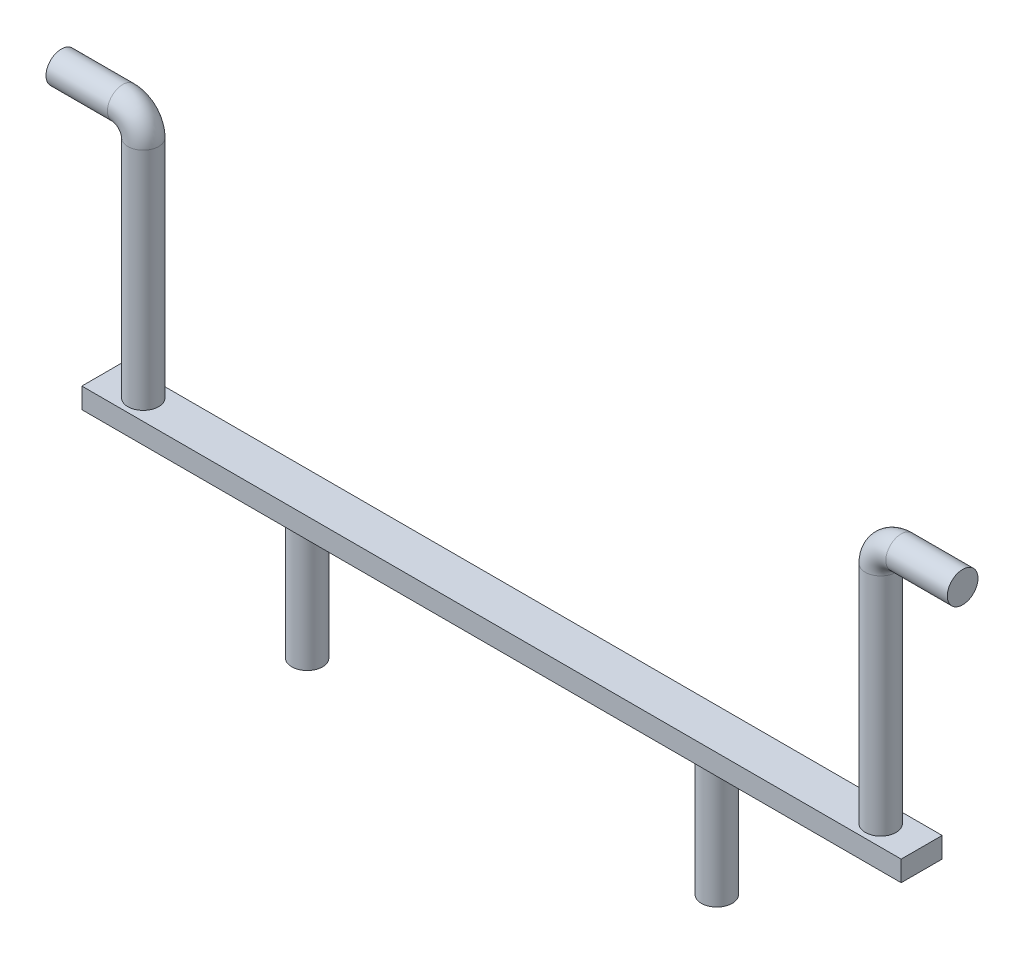
from build123d import *

# Parameters (mm, degrees)
SKETCH1_W           = 508
SKETCH1_H           = 25.4
BOSS_EXTRUDE1_DEPTH = 12.7
SKETCH3_R           = 9.525
BOSS_EXTRUDE2_DEPTH = 76.2
SWEEP1_PROFILE_R    = 9.525


with BuildPart() as part:
    # Sketch1 → Boss-Extrude1 (new body)
    with BuildSketch(Plane(origin=(0, 0, 0), x_dir=(1, 0, 0), z_dir=(0, 1, 0))):
        Rectangle(SKETCH1_W, SKETCH1_H)
    extrude(amount=BOSS_EXTRUDE1_DEPTH)

    # Sketch3 → Boss-Extrude2 (add)
    with BuildSketch(Plane.XZ):
        with Locations(Location((-127, 0, 0), (0, 0, 90))):
            Circle(SKETCH3_R)
        with Locations(Location((127, 0, 0), (0, 0, 90))):
            Circle(SKETCH3_R)
    extrude(amount=BOSS_EXTRUDE2_DEPTH)

    # Sweep1: sweep along a path in Sketch4
    with BuildLine(Plane.XY) as sweep1_path:
        Line((-228.6, 12.7), (-228.6, 152.4))
        ThreePointArc((-228.6, 152.4), (-232.319743879, 161.380256121), (-241.3, 165.1))
        Line((-241.3, 165.1), (-279.4, 165.1))
    # Sweep1 profile (on start of the path) → Sweep1 (sweep)
    with BuildSketch(Plane(origin=(-228.6, 12.7, 0), x_dir=(0, 0, 1), z_dir=(0, 1, 0))):
        Circle(SWEEP1_PROFILE_R)
    sweep1 = sweep(path=sweep1_path.line)

    # Mirror1: Sweep1 across plane
    add(sweep1.mirror(Plane(origin=(0, 0, 0), x_dir=(0, 0, 1), z_dir=(1, 0, 0))))


solid = part.part
